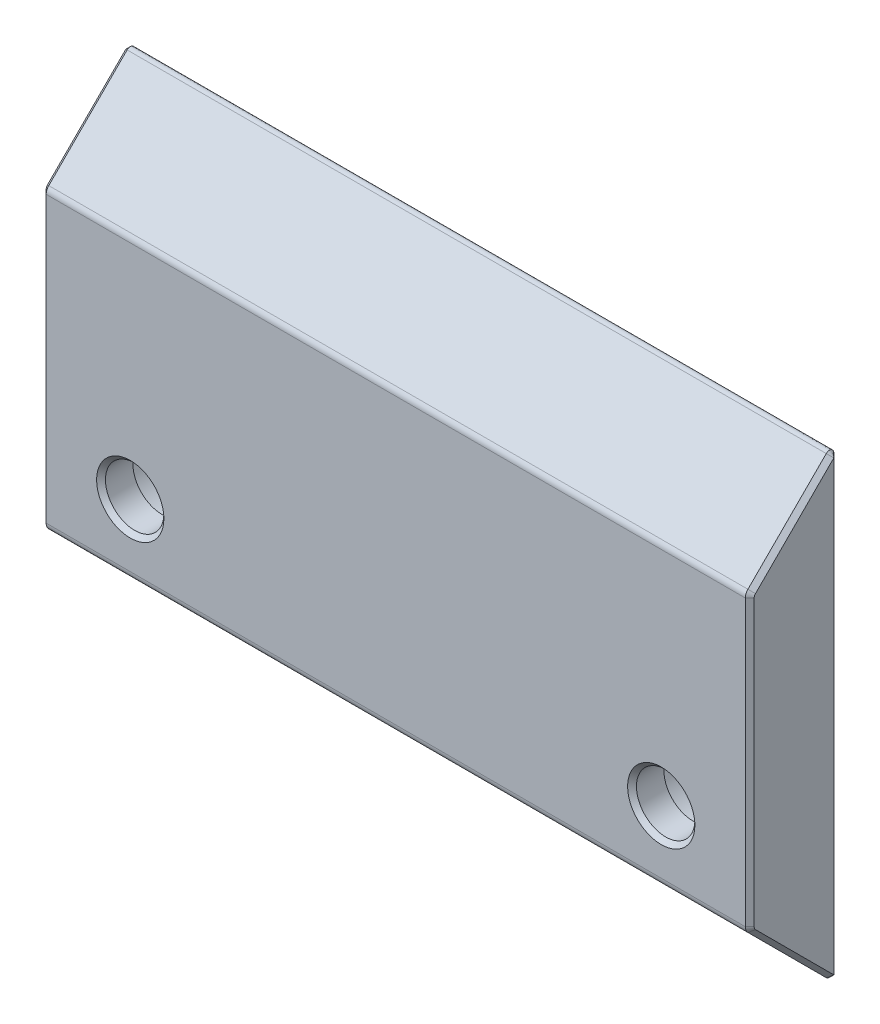
from build123d import *

# Parameters (mm, degrees)
BOSS_EXTRUDE1_DEPTH                                 = 80
CBORE_FOR_M6_HEX_SOCKET_HEAD_CAP_SCREW1_D           = 6.6
CBORE_FOR_M6_HEX_SOCKET_HEAD_CAP_SCREW1_CBORE_D     = 11
CBORE_FOR_M6_HEX_SOCKET_HEAD_CAP_SCREW1_CBORE_DEPTH = 6.4
FILLET1_R                                           = 0.5
FILLET2_R                                           = 1
CHAMFER1_SIZE                                       = 0.5
CHAMFER2_SIZE                                       = 0.5


with BuildPart() as part:
    # Sketch2 → Boss-Extrude1 (new body)
    with BuildSketch(Plane(origin=(0, 0, 0), x_dir=(0, 0, -1), z_dir=(1, 0, 0))):
        Polygon((0, 0), (0, 53), (-10, 43), (-10, 10), align=None)
    extrude(amount=BOSS_EXTRUDE1_DEPTH)

    # CBORE for M6 Hex Socket Head Cap Screw1 (through all)
    with Locations(Plane(origin=(0, 0, 0), x_dir=(-1, 0, 0), z_dir=(0, 0, -1))):
        with Locations((-70, 17.5), (-10, 17.5)):
            CounterBoreHole(CBORE_FOR_M6_HEX_SOCKET_HEAD_CAP_SCREW1_D / 2, CBORE_FOR_M6_HEX_SOCKET_HEAD_CAP_SCREW1_CBORE_D / 2, CBORE_FOR_M6_HEX_SOCKET_HEAD_CAP_SCREW1_CBORE_DEPTH)

    # Fillet1
    fillet1_edges = [part.edges().sort_by_distance(p)[0] for p in [
        (40, 53, 0),
        (40, 0, 0),
    ]]
    fillet(fillet1_edges, radius=FILLET1_R)

    # Fillet2
    fillet2_edges = [part.edges().sort_by_distance(p)[0] for p in [
        (40, 10, 10),
        (40, 43, 10),
    ]]
    fillet(fillet2_edges, radius=FILLET2_R)

    # Chamfer1
    chamfer1_edges = [part.edges().sort_by_distance(p)[0] for p in [
        (6.7, 17.5, 10),
        (66.7, 17.5, 10),
        (0, 47.719669914, 5.280330086),
        (80, 47.719669914, 5.280330086),
        (0, 26.5, 0),
        (0, 0.745167015, 0.308658284),
        (0, 52.254832985, 0.308658284),
        (80, 26.5, 0),
        (80, 0.745167015, 0.308658284),
        (80, 52.254832985, 0.308658284),
        (0, 26.5, 10),
        (80, 26.5, 10),
        (0, 5.280330086, 5.280330086),
        (0, 10.03153013, 9.923879533),
        (0, 42.96846987, 9.923879533),
        (80, 5.280330086, 5.280330086),
        (80, 10.03153013, 9.923879533),
        (80, 42.96846987, 9.923879533),
    ]]
    chamfer(chamfer1_edges, length=CHAMFER1_SIZE)

    # Chamfer2
    chamfer2_edges = [part.edges().sort_by_distance(p)[0] for p in [
        (15.5, 17.5, 0),
        (75.5, 17.5, 0),
    ]]
    chamfer(chamfer2_edges, length=CHAMFER2_SIZE)


solid = part.part
